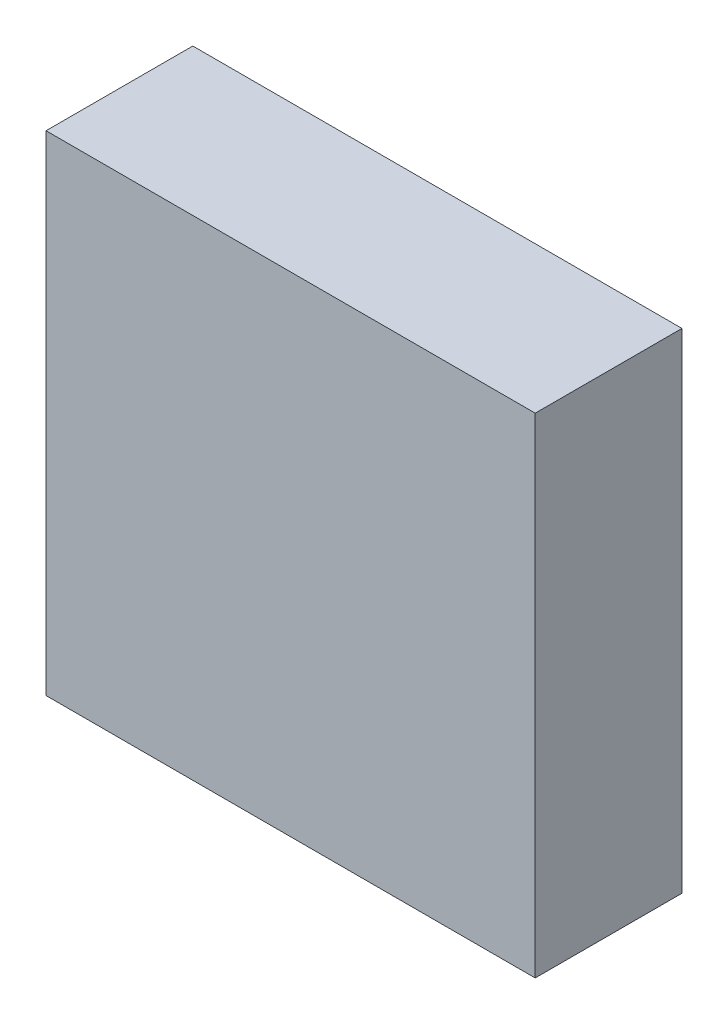
from build123d import *

# Parameters (mm, degrees)
SKETCH1_W           = 10
SKETCH1_H           = 10
BOSS_EXTRUDE1_DEPTH = 3


with BuildPart() as part:
    # Sketch1 → Boss-Extrude1 (new body)
    with BuildSketch(Plane.XY):
        Rectangle(SKETCH1_W, SKETCH1_H)
    extrude(amount=BOSS_EXTRUDE1_DEPTH)


solid = part.part
